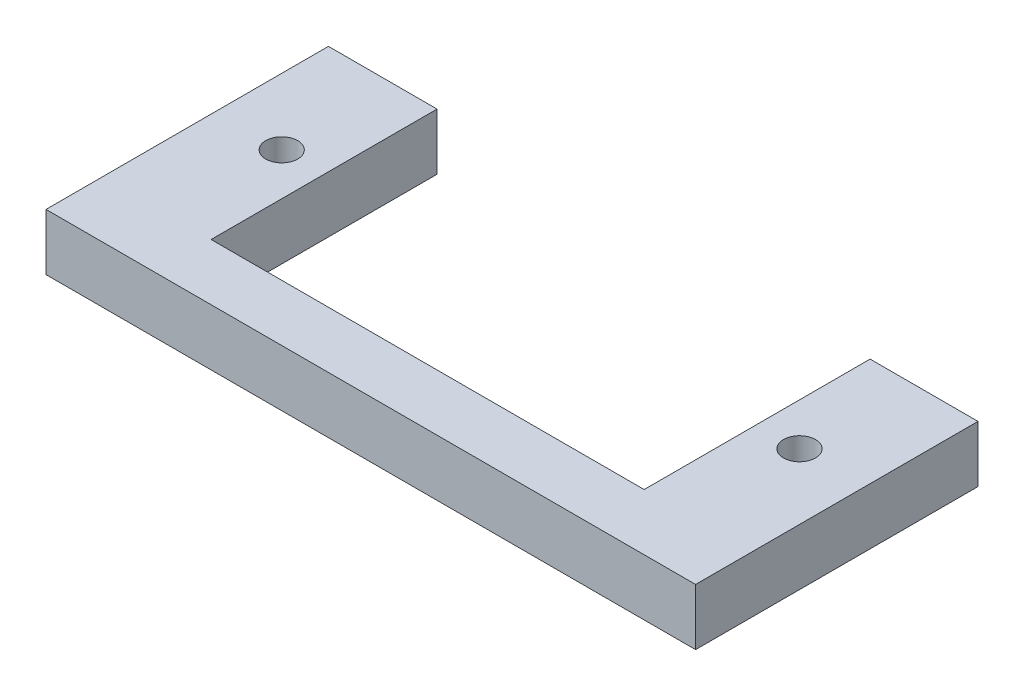
from build123d import *

# Parameters (mm, degrees)
SKETCH_1_R      = 0.85
EXTRUDE_1_DEPTH = 3


with BuildPart() as part:
    # 草图1 → 凸台-拉伸1 (new body)
    with BuildSketch(Plane(origin=(0, 0, 0), x_dir=(1, 0, 0), z_dir=(0, 1, 0))):
        Polygon((-46.341219144, 15), (-46.341219144, 0), (-11.841219144, 0), (-11.841219144, 15), (-17.571981334, 15), (-17.571981334, 3), (-40.571981334, 3), (-40.571981334, 15), align=None)
        with Locations(Location((-42.821981334, 9, 0), (0, 0, 270))):
            Circle(SKETCH_1_R, mode=Mode.SUBTRACT)
        with Locations(Location((-15.321981334, 9, 0), (0, 0, 90))):
            Circle(SKETCH_1_R, mode=Mode.SUBTRACT)
    extrude(amount=EXTRUDE_1_DEPTH)


solid = part.part
